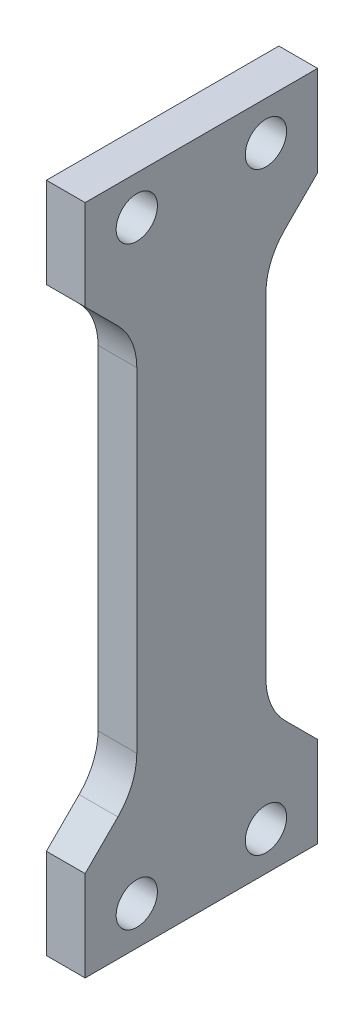
from build123d import *

# Parameters (mm, degrees)
SKETCH1_W           = 52.000002935
SKETCH1_H           = 18.000001088
SKETCH1_R           = 1.599502817
BOSS_EXTRUDE1_DEPTH = 2.999998629
SKETCH2_W           = 4
SKETCH2_H           = 30
CUT_EXTRUDE1_DEPTH  = 84.68851942
FILLET1_R           = 5


with BuildPart() as part:
    # Sketch1 → Boss-Extrude1 (new body)
    with BuildSketch(Plane(origin=(120.988696814, 0, 0), x_dir=(0, -1, 0), z_dir=(-1, 0, 0))):
        with Locations((49.005120062, 27.999999933)):
            Rectangle(SKETCH1_W, SKETCH1_H)
        with Locations(Location((26.005118371, 32.999999236, 0), (0, 0, 90))):
            Circle(SKETCH1_R, mode=Mode.SUBTRACT)
        with Locations(Location((26.005118371, 23.000000115, 0), (0, 0, 90))):
            Circle(SKETCH1_R, mode=Mode.SUBTRACT)
        with Locations(Location((72.005118202, 32.999999236, 0), (0, 0, 90))):
            Circle(SKETCH1_R, mode=Mode.SUBTRACT)
        with Locations(Location((72.005118202, 23.000000115, 0), (0, 0, 90))):
            Circle(SKETCH1_R, mode=Mode.SUBTRACT)
    extrude(amount=-BOSS_EXTRUDE1_DEPTH)

    # Sketch2 → Cut-Extrude1 (cut, through all)
    with BuildSketch(Plane.ZY.offset(-120.988696814)):
        with Locations((35.000000477, -49.005120061)):
            Rectangle(SKETCH2_W, SKETCH2_H)
        Polygon((33.000000477, -34.005120061), (37.000000477, -34.005120061), (37.000000477, -30.005120061), align=None)
        Polygon((22.999999389, -34.005120061), (18.999999389, -30.005120061), (18.999999389, -34.005120061), align=None)
        with Locations((20.999999389, -49.005120061)):
            Rectangle(SKETCH2_W, SKETCH2_H)
        Polygon((22.999999389, -64.005120061), (18.999999389, -64.005120061), (18.999999389, -68.005120061), align=None)
        Polygon((37.000000477, -68.005120061), (37.000000477, -64.005120061), (33.000000477, -64.005120061), align=None)
    extrude(amount=-CUT_EXTRUDE1_DEPTH, mode=Mode.SUBTRACT)

    # Fillet1
    fillet1_edges = [part.edges().sort_by_distance(p)[0] for p in [
        (122.488696128, -34.005120061, 22.999999389),
        (122.488696128, -64.005120061, 22.999999389),
        (122.488696128, -64.005120061, 33.000000477),
        (122.488696128, -34.005120061, 33.000000477),
    ]]
    fillet(fillet1_edges, radius=FILLET1_R)


solid = part.part
